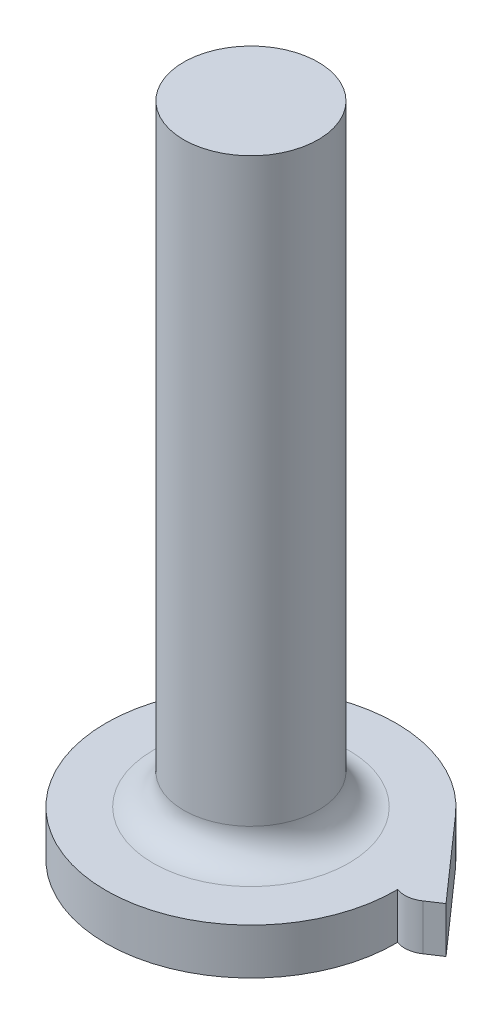
from build123d import *

# Parameters (mm, degrees)
SALIENTE_EXTRUIR1_DEPTH = 1.5
CROQUIS2_R              = 2.2
SALIENTE_EXTRUIR2_DEPTH = 20
FILLET2_R               = 1
SKETCH1_R               = 2.5
CUT_EXTRUDE1_DEPTH      = 0.5


with BuildPart() as part:
    # Croquis1 → Saliente-Extruir1 (new body)
    with BuildSketch(Plane(origin=(0, 0, 0), x_dir=(1, 0, 0), z_dir=(0, 1, 0))):
        with BuildLine():
            Line((-28.743638834, 108.856298042), (-28.28575881, 109.159080257))
            Line((-28.28575881, 109.159080257), (-30.66606326, 111.852582661))
            ThreePointArc((-30.66606326, 111.852582661), (-32.271190025, 113.035950486), (-34.220833362, 113.455095091))
            ThreePointArc((-34.220833362, 113.455095091), (-37.554900965, 105.336408582), (-29.477245058, 108.768689524))
            ThreePointArc((-29.477245058, 108.768689524), (-29.099722767, 108.722734742), (-28.743638834, 108.856298042))
        make_face()
    extrude(amount=SALIENTE_EXTRUIR1_DEPTH)

    # Croquis2 → Saliente-Extruir2 (add)
    with BuildSketch(Plane(origin=(0, 1.5, 0), x_dir=(1, 0, 0), z_dir=(0, 1, 0))):
        with Locations(Location((-34.220833362, 108.71115792, 0), (0, 0, 270))):
            Circle(CROQUIS2_R)
    extrude(amount=SALIENTE_EXTRUIR2_DEPTH)

    # Fillet2
    fillet2_edges = [part.edges().sort_by_distance(p)[0] for p in [
        (-34.220833362, 1.5, -110.91115792),
    ]]
    fillet(fillet2_edges, radius=FILLET2_R)

    # Sketch1 → Cut-Extrude1 (cut)
    with BuildSketch(Plane.XZ):
        with Locations(Location((-34.220833362, -108.71115792, 0), (0, 0, 270))):
            Circle(SKETCH1_R)
    extrude(amount=-CUT_EXTRUDE1_DEPTH, mode=Mode.SUBTRACT)


solid = part.part
